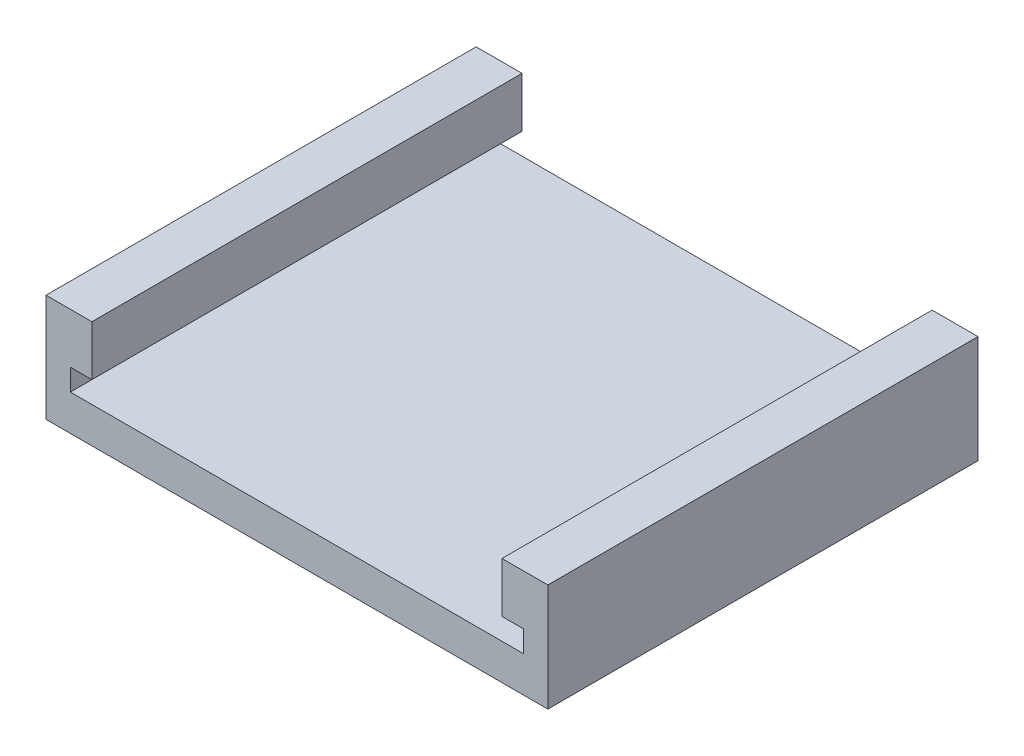
from build123d import *

# Parameters (mm, degrees)
SKETCH1_W           = 70
SKETCH1_H           = 60
BOSS_EXTRUDE1_DEPTH = 5
SKETCH2_W           = 3.4
SKETCH2_H           = 60
BOSS_EXTRUDE2_DEPTH = 10
SKETCH5_W           = 60
SKETCH5_H           = 7
BOSS_EXTRUDE5_DEPTH = 3
SKETCH6_W           = 60
SKETCH6_H           = 7
BOSS_EXTRUDE6_DEPTH = 3


with BuildPart() as part:
    # Sketch1 → Boss-Extrude1 (new body)
    with BuildSketch(Plane(origin=(0, 0, 0), x_dir=(1, 0, 0), z_dir=(0, 1, 0))):
        Rectangle(SKETCH1_W, SKETCH1_H)
    extrude(amount=BOSS_EXTRUDE1_DEPTH)

    # Sketch2 → Boss-Extrude2 (add)
    with BuildSketch(Plane(origin=(0, 5, 0), x_dir=(1, 0, 0), z_dir=(0, 1, 0))):
        with Locations((-33.3, 0)):
            Rectangle(SKETCH2_W, SKETCH2_H)
        with Locations((33.3, 0)):
            Rectangle(SKETCH2_W, SKETCH2_H)
    extrude(amount=BOSS_EXTRUDE2_DEPTH)

    # Sketch5 → Boss-Extrude5 (add)
    with BuildSketch(Plane(origin=(-31.6, 0, 0), x_dir=(0, 0, -1), z_dir=(1, 0, 0))):
        with Locations((0, 11.5)):
            Rectangle(SKETCH5_W, SKETCH5_H)
    extrude(amount=BOSS_EXTRUDE5_DEPTH)

    # Sketch6 → Boss-Extrude6 (add)
    with BuildSketch(Plane.ZY.offset(-31.6)):
        with Locations((0, 11.5)):
            Rectangle(SKETCH6_W, SKETCH6_H)
    extrude(amount=BOSS_EXTRUDE6_DEPTH)


solid = part.part
